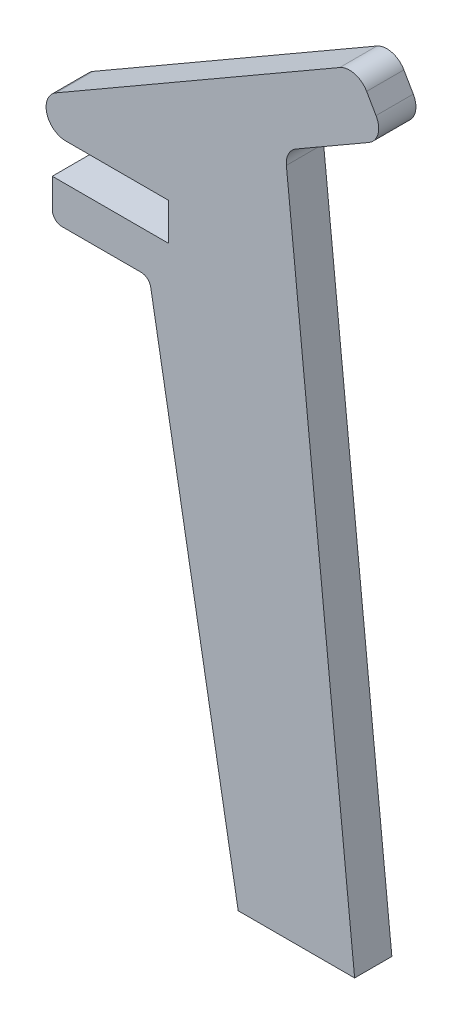
from build123d import *

# Parameters (mm, degrees)
BOSS_EXTRUDE1_DEPTH = 6.096
FILLET1_R           = 6.45
FILLET2_R           = 3.175


with BuildPart() as part:
    # Sketch1 → Boss-Extrude1 (new, symmetric)
    with BuildSketch(Plane.XY):
        Polygon((159.995567884, -85.917938074), (150.470567884, -69.420154132), (31.146005713, -138.312222222), (88.9, -138.312222222), (88.9, -150.504222222), (50.8, -150.504222222), (50.8, -163.204222222), (82.55, -163.204222222), (111.661584515, -328.304222222), (149.761584515, -328.304222222), (127, -104.967938074), align=None)
    extrude(amount=BOSS_EXTRUDE1_DEPTH, both=True)

    # Fillet1
    fillet1_edges = [part.edges().sort_by_distance(p)[0] for p in [
        (127, -104.967938074, 0),
        (31.146005713, -138.312222222, 0),
        (150.470567884, -69.420154132, 0),
        (159.995567884, -85.917938074, 0),
    ]]
    fillet(fillet1_edges, radius=FILLET1_R)

    # Fillet2
    fillet2_edges = [part.edges().sort_by_distance(p)[0] for p in [
        (82.55, -163.204222222, 0),
        (50.8, -163.204222222, 0),
    ]]
    fillet(fillet2_edges, radius=FILLET2_R)


solid = part.part
